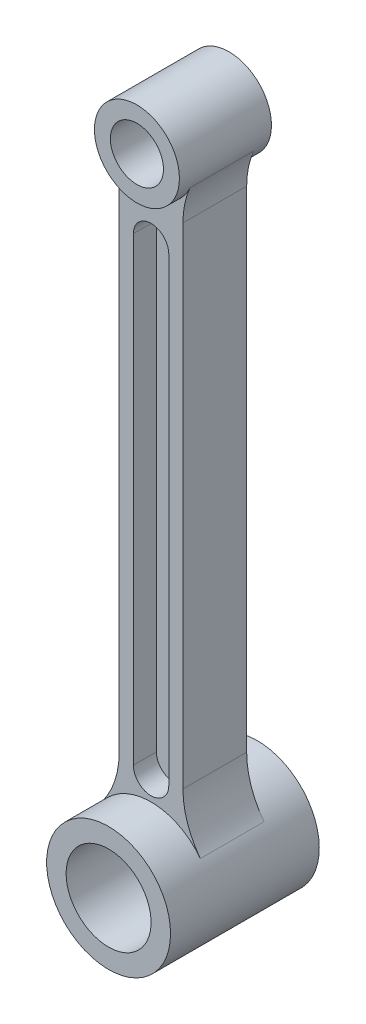
from build123d import *

# Parameters (mm, degrees)
SKETCH1_R           = 12
BOSS_EXTRUDE1_DEPTH = 21
SKETCH1_3_R         = 7.5
BOSS_EXTRUDE2_DEPTH = 13
BOSS_EXTRUDE3_DEPTH = 9
BOSS_EXTRUDE4_DEPTH = 2.5


with BuildPart() as part:
    # Sketch1 → Boss-Extrude1 (new, symmetric)
    with BuildSketch(Plane(origin=(0, 0, 0), x_dir=(0, 1, 0), z_dir=(0, 0, 1))):
        with BuildLine():
            ThreePointArc((17.5, 0), (15.683615343, 7.76364668), (10.611518883, 13.915662651))
            ThreePointArc((10.611518883, 13.915662651), (-17.5, 0), (10.611518883, -13.915662651))
            ThreePointArc((10.611518883, -13.915662651), (15.683615343, -7.76364668), (17.5, 0))
        make_face()
        Circle(SKETCH1_R, mode=Mode.SUBTRACT)
    extrude(amount=BOSS_EXTRUDE1_DEPTH, both=True)



with BuildPart() as body_2:
    # Sketch1<3> → Boss-Extrude2 (new, symmetric)
    with BuildSketch(Plane(origin=(0, 0, 0), x_dir=(0, 1, 0), z_dir=(0, 0, 1))):
        with BuildLine():
            ThreePointArc((190, 0), (184.574573055, 10.03867467), (173.204168477, 11))
            ThreePointArc((173.204168477, 11), (166, 0), (173.204168477, -11))
            ThreePointArc((173.204168477, -11), (184.574573055, -10.03867467), (190, 0))
        make_face()
        with Locations((178, 0)):
            Circle(SKETCH1_3_R, mode=Mode.SUBTRACT)
    extrude(amount=BOSS_EXTRUDE2_DEPTH, both=True)


with BuildPart() as part_1:
    add(part.part)

    add(body_2.part)  # Boss-Extrude3 merges body 2
    # Sketch1<4> → Boss-Extrude3 (add, symmetric)
    with BuildSketch(Plane(origin=(0, 0, 0), x_dir=(0, 1, 0), z_dir=(0, 0, 1))):
        with BuildLine():
            Line((163.61250543, 9), (25.164459064, 9))
            ThreePointArc((25.164459064, 9), (17.484097627, 10.26210106), (10.611518883, 13.915662651))
            ThreePointArc((10.611518883, 13.915662651), (15.683615343, 7.76364668), (17.5, 0))
            ThreePointArc((17.5, 0), (15.683615343, -7.76364668), (10.611518883, -13.915662651))
            ThreePointArc((10.611518883, -13.915662651), (17.484097627, -10.26210106), (25.164459064, -9))
            Line((25.164459064, -9), (163.61250543, -9))
            ThreePointArc((163.61250543, -9), (168.511484916, -9.505319751), (173.204168477, -11))
            ThreePointArc((173.204168477, -11), (166, 0), (173.204168477, 11))
            ThreePointArc((173.204168477, 11), (168.511484916, 9.505319751), (163.61250543, 9))
        make_face()
        with BuildLine():
            ThreePointArc((24, -5), (19, 0), (24, 5))
            Line((24, 5), (154, 5))
            ThreePointArc((154, 5), (159, 0), (154, -5))
            Line((154, -5), (24, -5))
        make_face(mode=Mode.SUBTRACT)
    extrude(amount=BOSS_EXTRUDE3_DEPTH, both=True)

    # Sketch1<5> → Boss-Extrude4 (add, symmetric)
    with BuildSketch(Plane(origin=(0, 0, 0), x_dir=(0, 1, 0), z_dir=(0, 0, 1))):
        with BuildLine():
            Line((154, 5), (24, 5))
            ThreePointArc((24, 5), (19, 0), (24, -5))
            Line((24, -5), (154, -5))
            ThreePointArc((154, -5), (159, 0), (154, 5))
        make_face()
    extrude(amount=BOSS_EXTRUDE4_DEPTH, both=True)


solid = part_1.part
